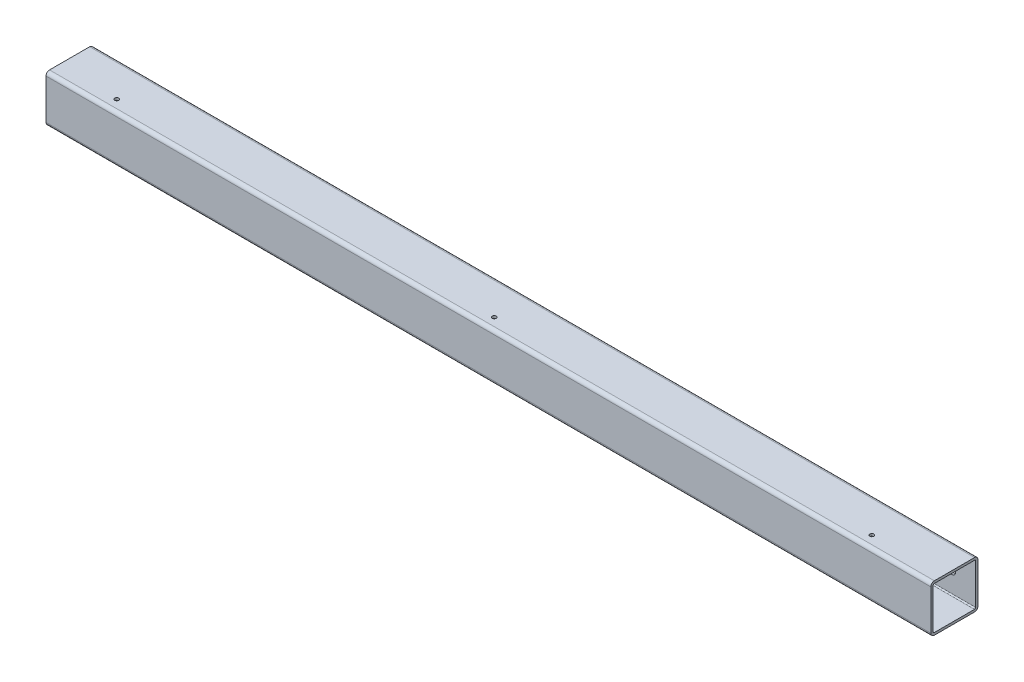
from build123d import *

# Parameters (mm, degrees)
MEMBER_1_DEPTH               = 1500
HOLE_WIZARD_M10_1_AT_2_COUNT = 2
HOLE_WIZARD_M10_1_AT_2_PITCH = 80
HOLE_WIZARD_M8_2_D           = 6.8
HOLE_WIZARD_M8_2_DEPTH       = 22.25
HOLE_WIZARD_M8_2_TIP         = 2.042926105


with BuildPart() as part:
    # Sketch11 → Member 1 (new body)
    with BuildSketch(Plane.YZ):
        with BuildLine():
            Line((-34, -40), (34, -40))
            ThreePointArc((34, -40), (38.242640687, -38.242640687), (40, -34))
            Line((40, -34), (40, 34))
            ThreePointArc((40, 34), (38.242640687, 38.242640687), (34, 40))
            Line((34, 40), (-34, 40))
            ThreePointArc((-34, 40), (-38.242640687, 38.242640687), (-40, 34))
            Line((-40, 34), (-40, -34))
            ThreePointArc((-40, -34), (-38.242640687, -38.242640687), (-34, -40))
        make_face()
        with BuildLine():
            Line((-34, -36), (34, -36))
            ThreePointArc((34, -36), (35.414213562, -35.414213562), (36, -34))
            Line((36, -34), (36, 34))
            ThreePointArc((36, 34), (35.414213562, 35.414213562), (34, 36))
            Line((34, 36), (-34, 36))
            ThreePointArc((-34, 36), (-35.414213562, 35.414213562), (-36, 34))
            Line((-36, 34), (-36, -34))
            ThreePointArc((-36, -34), (-35.414213562, -35.414213562), (-34, -36))
        make_face(mode=Mode.SUBTRACT)
    extrude(amount=MEMBER_1_DEPTH)

    # 草图4 → M10 间隙孔1 (revolve, cut)
    with BuildSketch(Plane(origin=(1380, 0, -36), x_dir=(0, -1, 0), z_dir=(1, 0, 0))):
        Polygon((0, 0), (0, 33.605163714), (6, 30), (6, 0), align=None)
    hole_wizard_m10_1 = revolve(axis=Axis((1380, 0, -29.65), (0, 0, -1)), mode=Mode.SUBTRACT)

    # M10 间隙孔1 at 2: M10 间隙孔1 ×2
    with Locations(*[(i * HOLE_WIZARD_M10_1_AT_2_PITCH, 0, 0) for i in range(1, HOLE_WIZARD_M10_1_AT_2_COUNT)]):
        add(hole_wizard_m10_1, mode=Mode.SUBTRACT)

    # 镜向1: M10 间隙孔1 across plane
    add(hole_wizard_m10_1.mirror(Plane.ZY.offset(-750)), mode=Mode.SUBTRACT)

    # 镜向1 copy 1 sketch → 镜向1 copy 1 (revolve, cut)
    with BuildSketch(Plane(origin=(40, 0, -36), x_dir=(0, -1, 0), z_dir=(-1, 0, 0))):
        Polygon((0, 0), (0, -33.605163714), (6, -30), (6, 0), align=None)
    revolve(axis=Axis((40, 0, -29.65), (0, 0, 1)), mode=Mode.SUBTRACT)

    # M8 螺纹孔2
    with Locations(Plane(origin=(0, 40, 0), x_dir=(-1, 0, 0), z_dir=(0, 1, 0))):
        with Locations((-100.000000009, 20), (-740.000000009, 20), (-1380.000000009, 20), (-1580.000000007, 20), (-2220.000000007, 20), (-2860.000000007, 20)):
            Hole(HOLE_WIZARD_M8_2_D / 2, depth=HOLE_WIZARD_M8_2_DEPTH)
            with Locations((0, 0, -(HOLE_WIZARD_M8_2_DEPTH + HOLE_WIZARD_M8_2_TIP / 2))):  # 118° drill point
                Cone(0, HOLE_WIZARD_M8_2_D / 2, HOLE_WIZARD_M8_2_TIP, mode=Mode.SUBTRACT)


solid = part.part
